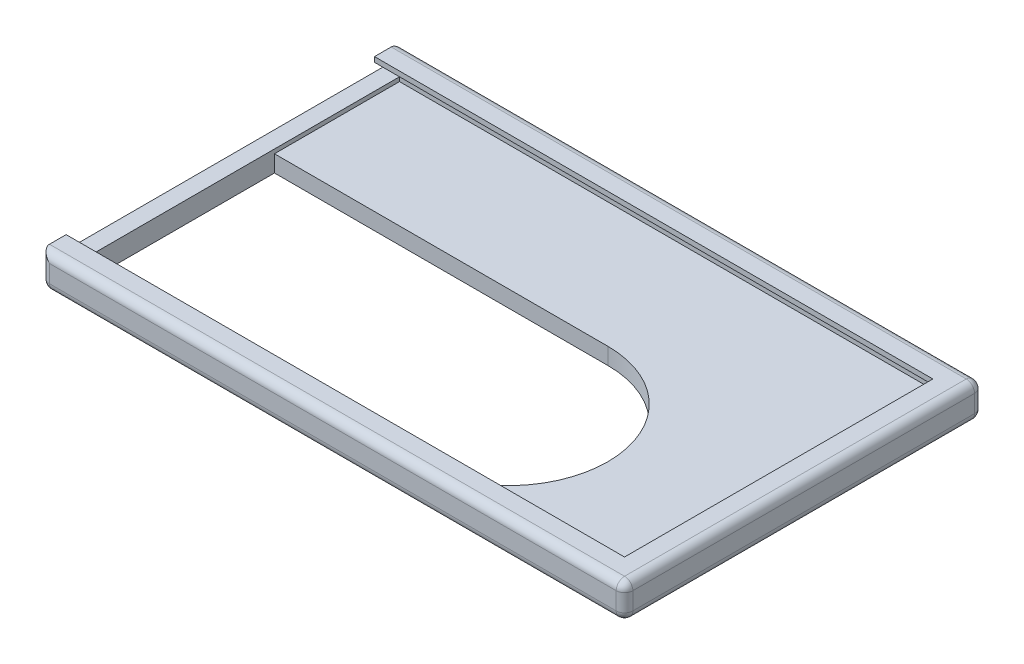
from build123d import *

# Parameters (mm, degrees)
BOSS_EXTRUDE1_DEPTH = 2
SKETCH1_3_W         = 70
SKETCH1_3_H         = 43
BOSS_EXTRUDE2_DEPTH = 4
SKETCH1_5_W         = 40
SKETCH1_5_H         = 24
CUT_EXTRUDE4_DEPTH  = 2
CUT_EXTRUDE5_REACH  = 81.505
SKETCH2_W           = 39
SKETCH2_H           = 1.5
BOSS_EXTRUDE3_START = -0.5
BOSS_EXTRUDE3_DEPTH = 0.6
FILLET1_R           = 1


with BuildPart() as part:
    # Sketch1 → Boss-Extrude1 (new body)
    with BuildSketch(Plane(origin=(0, 0, 0), x_dir=(1, 0, 0), z_dir=(0, 1, 0))):
        Polygon((0, 0), (64, 0), (66, 0), (66, -1), (66, -38), (66, -39), (64, -39), (0, -39), align=None)
    extrude(amount=BOSS_EXTRUDE1_DEPTH)

    # Sketch1<3> → Boss-Extrude2 (add)
    with BuildSketch(Plane(origin=(0, 0, 0), x_dir=(1, 0, 0), z_dir=(0, 1, 0))):
        with Locations((33, -19.5)):
            Rectangle(SKETCH1_3_W, SKETCH1_3_H)
        Polygon((0, 0), (64, 0), (66, 0), (66, -1), (66, -38), (66, -39), (64, -39), (0, -39), align=None, mode=Mode.SUBTRACT)
    extrude(amount=BOSS_EXTRUDE2_DEPTH)

    # Sketch1<5> → Cut-Extrude4 (cut)
    with BuildSketch(Plane(origin=(0, 0, 0), x_dir=(1, 0, 0), z_dir=(0, 1, 0))):
        with Locations((20, -27)):
            Rectangle(SKETCH1_5_W, SKETCH1_5_H)
        with BuildLine():
            ThreePointArc((40, -15), (52, -27), (40, -39))
            Line((40, -39), (40, -15))
        make_face()
    extrude(amount=CUT_EXTRUDE4_DEPTH, mode=Mode.SUBTRACT)

    # Sketch2 → Cut-Extrude5 (cut, up to next)
    with BuildSketch(Plane(origin=(0, 0, 0), x_dir=(0, 0, -1), z_dir=(1, 0, 0)), mode=Mode.PRIVATE) as cut_extrude5_sk1:
        with Locations((-19.5, 3.25)):
            Rectangle(SKETCH2_W, SKETCH2_H)
    cut_extrude5_tool1 = extrude(cut_extrude5_sk1.sketch, amount=-CUT_EXTRUDE5_REACH, mode=Mode.PRIVATE) & part.part
    add(cut_extrude5_tool1.solids().sort_by_distance((0, 3.25, 19.5))[0], mode=Mode.SUBTRACT)

    # Sketch3 → Boss-Extrude3 (add)
    with BuildSketch(Plane(origin=(0, 4, 0), x_dir=(1, 0, 0), z_dir=(0, 1, 0)).offset(BOSS_EXTRUDE3_START)):
        Polygon((-2, -41), (68, -41), (68, 2), (-2, 2), (-2, -1), (65, -1), (65, -38), (-2, -38), align=None)
    extrude(amount=BOSS_EXTRUDE3_DEPTH)

    # Fillet1
    fillet1_edges = [part.edges().sort_by_distance(p)[0] for p in [
        (68, 2.05, -2),
        (-2, 0, 19.5),
        (-2, 2.05, -2),
        (33, 0, 41),
        (-2, 2.05, 41),
        (68, 2.05, 41),
        (33, 0, -2),
        (68, 0, 19.5),
        (33, 4.1, 41),
        (68, 4.1, 19.5),
        (33, 4.1, -2),
    ]]
    fillet(fillet1_edges, radius=FILLET1_R)


solid = part.part
